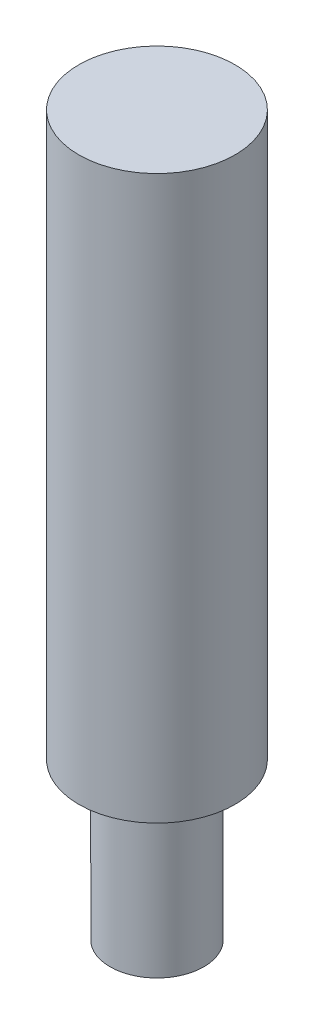
from build123d import *

# Parameters (mm, degrees)
SKETCH1_R           = 2.5
BOSS_EXTRUDE1_DEPTH = 18
SKETCH2_R           = 1.5
BOSS_EXTRUDE2_DEPTH = 5


with BuildPart() as part:
    # Sketch1 → Boss-Extrude1 (new body)
    with BuildSketch(Plane(origin=(0, 0, 0), x_dir=(1, 0, 0), z_dir=(0, 1, 0))):
        with Locations(Location((0, 0, 0), (0, 0, 270))):
            Circle(SKETCH1_R)
    extrude(amount=BOSS_EXTRUDE1_DEPTH)

    # Sketch2 → Boss-Extrude2 (add)
    with BuildSketch(Plane(origin=(0, 0, 0), x_dir=(-1, 0, 0), z_dir=(0, -1, 0))):
        with Locations(Location((0, 0, 0), (0, 0, 270))):
            Circle(SKETCH2_R)
    extrude(amount=BOSS_EXTRUDE2_DEPTH)


solid = part.part
